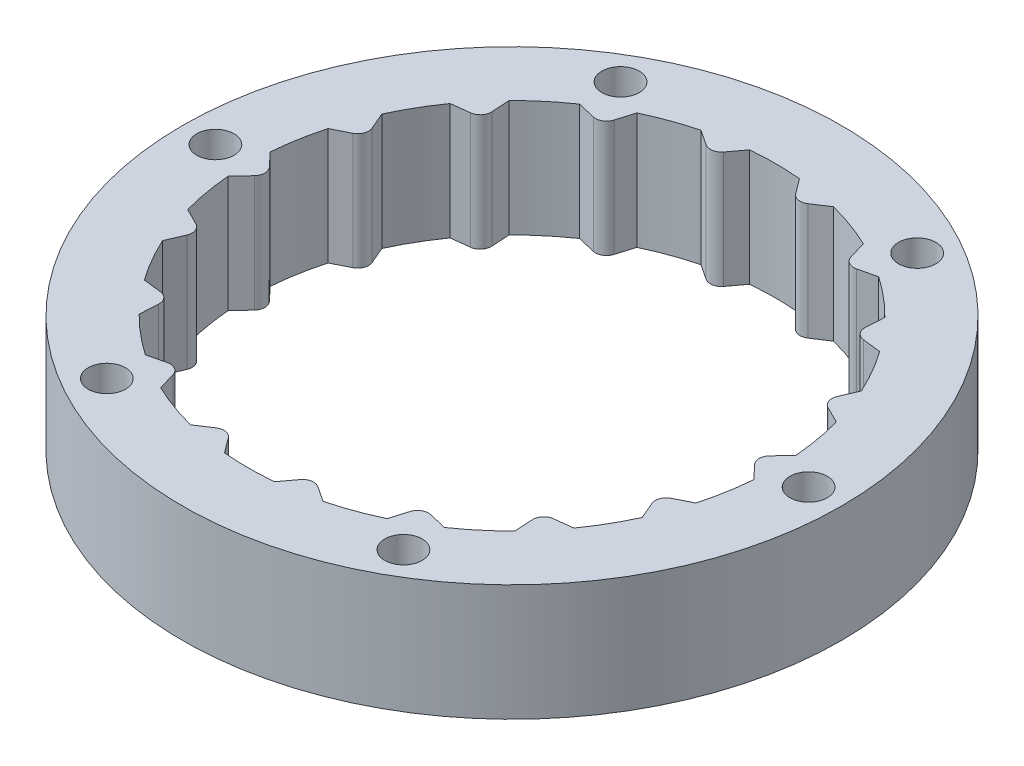
from build123d import *

# Parameters (mm, degrees)
SKETCH1_W            = 6
SKETCH1_H            = 10.6
BOSS_EXTRUDE1_DEPTH  = 10.6
CIRPATTERN2_COUNT    = 18
M3_CLEARANCE_HOLE1_D = 3.4
CIRPATTERN1_COUNT    = 6


with BuildPart() as part:
    # Sketch1 → Revolve1 (revolve)
    with BuildSketch(Plane.XY, mode=Mode.PRIVATE) as revolve1_sk:
        with Locations((27, 5.3)):
            Rectangle(SKETCH1_W, SKETCH1_H)
    revolve(revolve1_sk.sketch.rotate(Axis((0, 22.026442308, 0), (0, -1, 0)), 180), axis=Axis((0, 22.026442308, 0), (0, -1, 0)))

    # Sketch4 → Boss-Extrude1 (add)
    with BuildSketch(Plane(origin=(0, 10.6, 0), x_dir=(1, 0, 0), z_dir=(0, 1, 0))):
        with BuildLine():
            Line((22.771936798, 0.68551001), (29.077470181, 7.382460828))
            ThreePointArc((29.077470181, 7.382460828), (30, 0), (29.077470181, -7.382460828))
            Line((29.077470181, -7.382460828), (22.771936798, -0.68551001))
            ThreePointArc((22.771936798, -0.68551001), (22.5, 0), (22.771936798, 0.68551001))
        make_face()
    boss_extrude1 = extrude(amount=-BOSS_EXTRUDE1_DEPTH)

    # CirPattern2: Boss-Extrude1 ×18 about axis
    cirpattern2_axis = Axis((0, 0, 0), (0, 1, 0))
    for i in range(1, CIRPATTERN2_COUNT):
        add(boss_extrude1.rotate(cirpattern2_axis, i * 360 / CIRPATTERN2_COUNT))

    # M3 Clearance Hole1 (through all)
    with Locations(Plane(origin=(0, 10.6, 0), x_dir=(1, 0, 0), z_dir=(0, 1, 0))):
        with Locations((27, 0)):
            m3_clearance_hole1 = Hole(M3_CLEARANCE_HOLE1_D / 2)

    # CirPattern1: M3 Clearance Hole1 ×6 about axis
    cirpattern1_axis = Axis((0, 0, 0), (0, 1, 0))
    for i in range(1, CIRPATTERN1_COUNT):
        add(m3_clearance_hole1.rotate(cirpattern1_axis, i * 360 / CIRPATTERN1_COUNT), mode=Mode.SUBTRACT)


solid = part.part
